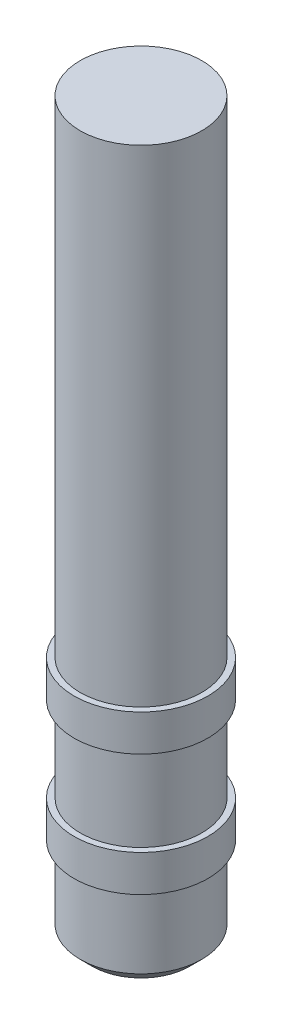
from build123d import *

# Parameters (mm, degrees)
SKETCH1_R           = 5
BOSS_EXTRUDE1_DEPTH = 60
BOSS_EXTRUDE2_START = -43
SKETCH2_R           = 5.5
BOSS_EXTRUDE2_DEPTH = 3
CHAMFER1_SIZE       = 1
BOSS_EXTRUDE3_START = -7
SKETCH3_R           = 5.5
BOSS_EXTRUDE3_DEPTH = 3


with BuildPart() as part:
    # Sketch1 → Boss-Extrude1 (new body)
    with BuildSketch(Plane(origin=(0, 0, 0), x_dir=(1, 0, 0), z_dir=(0, 1, 0))):
        with Locations(Location((0, 0, 0), (0, 0, 270))):
            Circle(SKETCH1_R)
    extrude(amount=BOSS_EXTRUDE1_DEPTH)

    # Sketch2 → Boss-Extrude2 (add)
    with BuildSketch(Plane(origin=(0, 60, 0), x_dir=(1, 0, 0), z_dir=(0, 1, 0)).offset(BOSS_EXTRUDE2_START)):
        with Locations(Location((0, 0, 0), (0, 0, 270))):
            Circle(SKETCH2_R)
    extrude(amount=BOSS_EXTRUDE2_DEPTH)

    # Chamfer1
    chamfer1_edges = [part.edges().sort_by_distance(p)[0] for p in [
        (0, 0, -5),
    ]]
    chamfer(chamfer1_edges, length=CHAMFER1_SIZE)

    # Sketch3 → Boss-Extrude3 (add)
    with BuildSketch(Plane.XZ.offset(BOSS_EXTRUDE3_START)):
        with Locations(Location((0, 0, 0), (0, 0, 90))):
            Circle(SKETCH3_R)
    extrude(amount=-BOSS_EXTRUDE3_DEPTH)


solid = part.part
